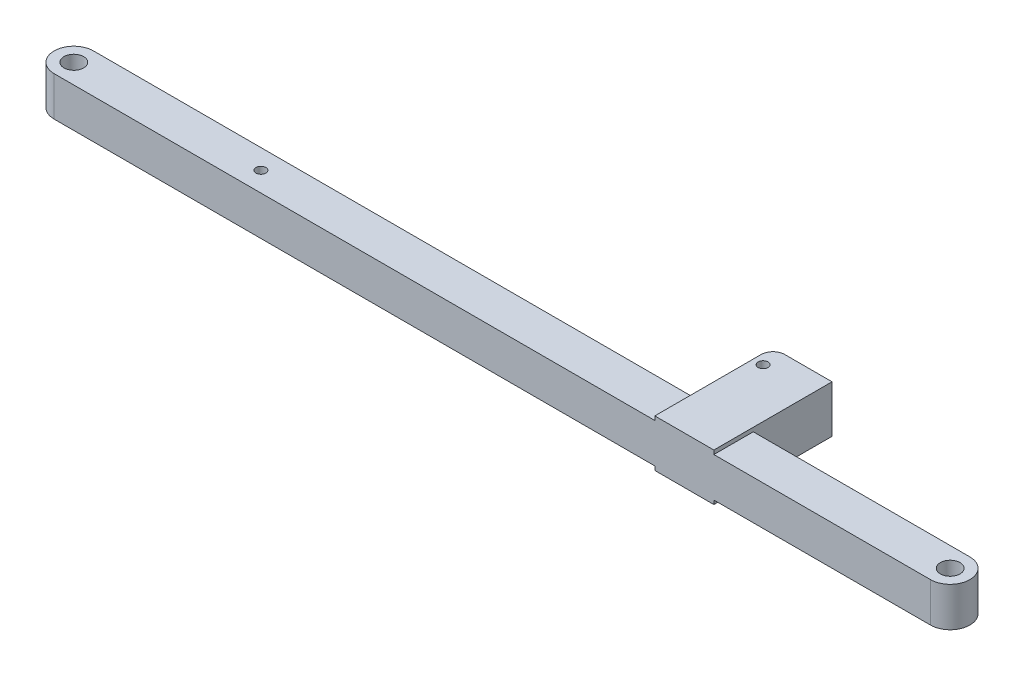
from build123d import *

# Parameters (mm, degrees)
SKETCH2_R           = 6.35
SKETCH2_R_2         = 3.175
BOSS_EXTRUDE1_DEPTH = 25.4
SKETCH12_W          = 38.1
SKETCH12_H          = 25.4
SKETCH12_H_2        = 2.54
BOSS_EXTRUDE2_DEPTH = 25.4
BOSS_EXTRUDE3_DEPTH = 50.8
SKETCH14_R          = 3.175
CUT_EXTRUDE1_DEPTH  = 39.624
FILLET1_R           = 7.62


with BuildPart() as part:
    # Sketch2 → Boss-Extrude1 (new body)
    with BuildSketch(Plane(origin=(0, 0, 0), x_dir=(1, 0, 0), z_dir=(0, 1, 0))):
        with BuildLine():
            ThreePointArc((0, 25.4), (-12.7, 12.7), (0, 0))
            Line((0, 0), (565.15, 0))
            ThreePointArc((565.15, 0), (577.85, 12.7), (565.15, 25.4))
            Line((565.15, 25.4), (0, 25.4))
        make_face()
        with Locations(Location((0, 12.7, 0), (0, 0, 270))):
            Circle(SKETCH2_R, mode=Mode.SUBTRACT)
        with Locations(Location((120.65, 12.7, 0), (0, 0, 270))):
            Circle(SKETCH2_R_2, mode=Mode.SUBTRACT)
        with Locations(Location((565.15, 12.7, 0), (0, 0, 270))):
            Circle(SKETCH2_R, mode=Mode.SUBTRACT)
    extrude(amount=BOSS_EXTRUDE1_DEPTH)

    # Sketch12 → Boss-Extrude2 (add)
    with BuildSketch(Plane(origin=(0, 0, -25.4), x_dir=(-1, 0, 0), z_dir=(0, 0, -1))):
        with Locations((-406.4, 12.7)):
            Rectangle(SKETCH12_W, SKETCH12_H)
        with Locations((-406.4, -1.27)):
            Rectangle(SKETCH12_W, SKETCH12_H_2)
        with Locations((-406.4, 26.67)):
            Rectangle(SKETCH12_W, SKETCH12_H_2)
    extrude(amount=-BOSS_EXTRUDE2_DEPTH)

    # Sketch13 → Boss-Extrude3 (add)
    with BuildSketch(Plane(origin=(0, 0, -25.4), x_dir=(-1, 0, 0), z_dir=(0, 0, -1))):
        Polygon((-387.35, 27.94), (-425.45, 27.94), (-425.45, 25.4), (-425.45, 0), (-425.45, -2.54), (-387.35, -2.54), (-387.35, 0), (-387.35, 3.81), (-419.1, 3.81), (-419.1, 21.59), (-387.35, 21.59), (-387.35, 25.4), align=None)
    extrude(amount=BOSS_EXTRUDE3_DEPTH)

    # Sketch14 → Cut-Extrude1 (cut, symmetric)
    with BuildSketch(Plane.XZ.offset(-21.59)):
        with Locations(Location((393.7, -63.5, 0), (0, 0, 90))):
            Circle(SKETCH14_R)
    extrude(amount=CUT_EXTRUDE1_DEPTH, both=True, mode=Mode.SUBTRACT)

    # Fillet1
    fillet1_edges = [part.edges().sort_by_distance(p)[0] for p in [
        (387.35, 24.765, -76.2),
        (387.35, 0.635, -76.2),
    ]]
    fillet(fillet1_edges, radius=FILLET1_R)


solid = part.part
